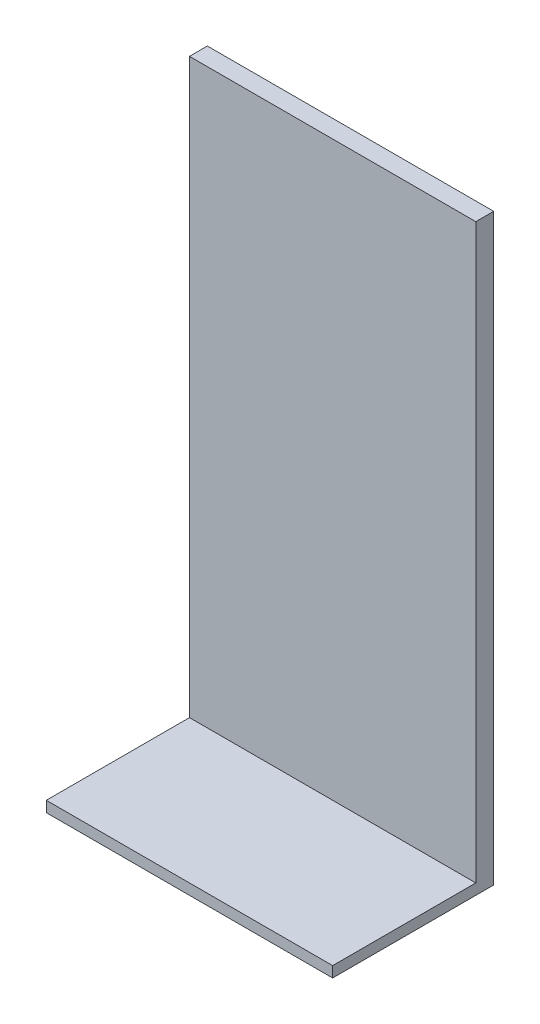
from build123d import *

# Parameters (mm, degrees)
BOSS_EXTRUDE1_DEPTH = 80


with BuildPart() as part:
    # Sketch1 → Boss-Extrude1 (new body)
    with BuildSketch(Plane(origin=(0, 0, 0), x_dir=(0, 0, -1), z_dir=(1, 0, 0))):
        Polygon((0, 0), (-45, 0), (-45, 3), (-5, 3), (-5, 163), (0, 163), align=None)
    extrude(amount=BOSS_EXTRUDE1_DEPTH)


solid = part.part
